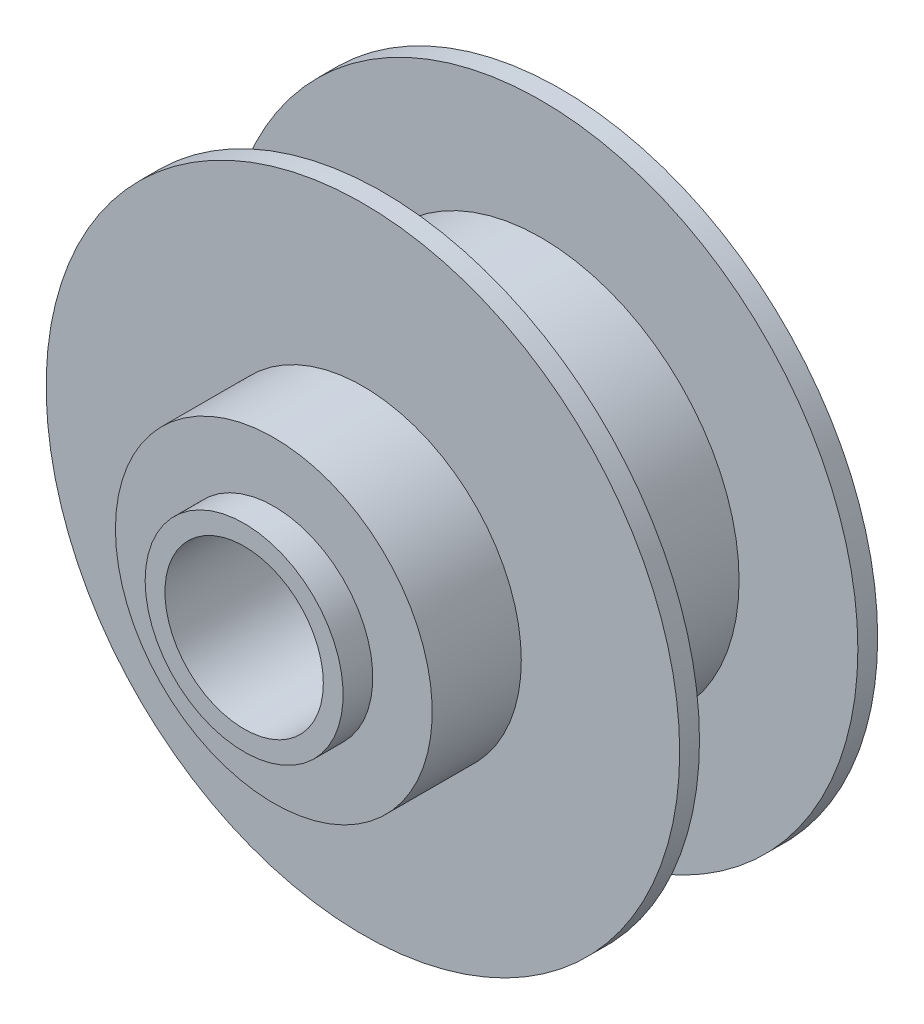
from build123d import *

# Parameters (mm, degrees)
ESQUISSE1_R             = 16
BOSS_EXTRU_1_DEPTH      = 10
ESQUISSE2_R             = 8
BOSS_EXTRU_2_DEPTH      = 6
ESQUISSE3_R             = 4
ENL_V_MAT_EXTRU_1_DEPTH = 28.712812921
ESQUISSE4_W             = 8
ESQUISSE4_H             = 6
ESQUISSE5_W             = 1.5
ESQUISSE5_H             = 3


with BuildPart() as part:
    # Esquisse1 → Boss.-Extru.1 (new body)
    with BuildSketch(Plane.XY):
        Circle(ESQUISSE1_R)
    extrude(amount=BOSS_EXTRU_1_DEPTH)

    # Esquisse2 → Boss.-Extru.2 (add)
    with BuildSketch(Plane.XY.offset(10)):
        Circle(ESQUISSE2_R)
    extrude(amount=BOSS_EXTRU_2_DEPTH)

    # Esquisse3 → Enlèv. mat.-Extru.1 (cut, through all)
    with BuildSketch(Plane.XY.offset(16)):
        Circle(ESQUISSE3_R)
    extrude(amount=-ENL_V_MAT_EXTRU_1_DEPTH, mode=Mode.SUBTRACT)

    # Esquisse4 → Enlèvement de matière-Révolution1 (revolve, cut)
    with BuildSketch(Plane(origin=(0, 0, 0), x_dir=(0, 0, -1), z_dir=(1, 0, 0)), mode=Mode.PRIVATE) as enl_vement_de_mati_re_r_volution1_sk:
        with Locations((-5, 13)):
            Rectangle(ESQUISSE4_W, ESQUISSE4_H)
    revolve(enl_vement_de_mati_re_r_volution1_sk.sketch.rotate(Axis((0, 0, 0), (0, 0, -1)), 90), axis=Axis((0, 0, 0), (0, 0, -1)), mode=Mode.SUBTRACT)

    # Esquisse5 → Enlèvement de matière-Révolution2 (revolve, cut)
    with BuildSketch(Plane(origin=(0, 0, 0), x_dir=(0, 0, -1), z_dir=(1, 0, 0)), mode=Mode.PRIVATE) as enl_vement_de_mati_re_r_volution2_sk:
        with Locations((-15.25, 6.5)):
            Rectangle(ESQUISSE5_W, ESQUISSE5_H)
    revolve(enl_vement_de_mati_re_r_volution2_sk.sketch.rotate(Axis((0, 0, 0), (0, 0, 1)), 90), axis=Axis((0, 0, 0), (0, 0, 1)), mode=Mode.SUBTRACT)


solid = part.part
